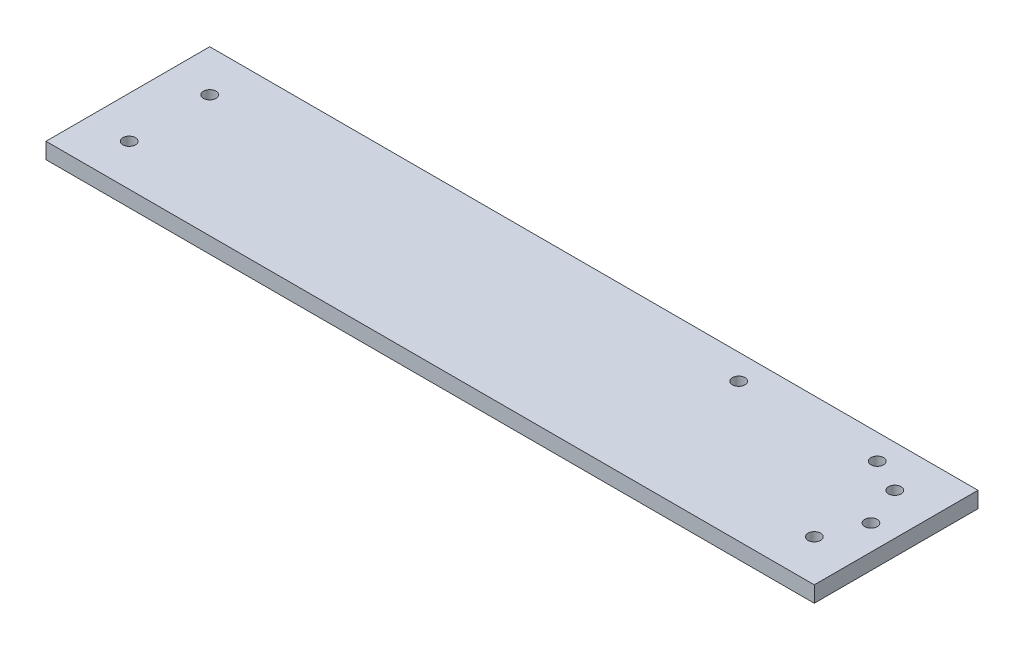
from build123d import *

# Parameters (mm, degrees)
SKETCH1_W               = 305
SKETCH1_H               = 65
BOSS_EXTRUDE1_DEPTH     = 3.175
CUT_EXTRUDE2_START      = -3.175
SKETCH4_R               = 2.5
CUT_EXTRUDE2_DEPTH      = 6.35
CUT_EXTRUDE3_DEPTH      = 157.053908955
CUT_EXTRUDE3_DEPTH_BACK = 157.053908955
SKETCH5_R               = 2.5


with BuildPart() as part:
    # Sketch1 → Boss-Extrude1 (new, symmetric)
    with BuildSketch(Plane(origin=(0, 0, 0), x_dir=(1, 0, 0), z_dir=(0, 1, 0))):
        Rectangle(SKETCH1_W, SKETCH1_H)
    extrude(amount=BOSS_EXTRUDE1_DEPTH, both=True)

    # Sketch4 → Cut-Extrude2 (cut)
    with BuildSketch(Plane(origin=(-2.5, 0, 0), x_dir=(-1, 0, 0), z_dir=(0, -1, 0)).offset(CUT_EXTRUDE2_START)):
        with Locations(Location((133.48, -15.98, 0), (0, 0, 90))):
            Circle(SKETCH4_R)
        with Locations(Location((133.48, 15.98, 0), (0, 0, 270))):
            Circle(SKETCH4_R)
    cut_extrude2 = extrude(amount=CUT_EXTRUDE2_DEPTH, mode=Mode.SUBTRACT)

    # Mirror2: Cut-Extrude2 across plane
    add(cut_extrude2.mirror(Plane(origin=(0, 0, 0), x_dir=(0, 0, 1), z_dir=(1, 0, 0))), mode=Mode.SUBTRACT)

    # Sketch5 → Cut-Extrude3 (cut, two sides: drawn at the far end of the back side and taken through both)
    with BuildSketch(Plane(origin=(0, 3.175, 0), x_dir=(1, 0, 0), z_dir=(0, 1, 0)).offset(-CUT_EXTRUDE3_DEPTH_BACK)):
        with Locations(Location((122.5, 22.5, 0), (0, 0, 270))):
            Circle(SKETCH5_R)
        with Locations(Location((67.5, 22.5, 0), (0, 0, 270))):
            Circle(SKETCH5_R)
        with Locations(Location((142.5, 0, 0), (0, 0, 270))):
            Circle(SKETCH5_R)
    extrude(amount=CUT_EXTRUDE3_DEPTH + CUT_EXTRUDE3_DEPTH_BACK, mode=Mode.SUBTRACT)


solid = part.part
